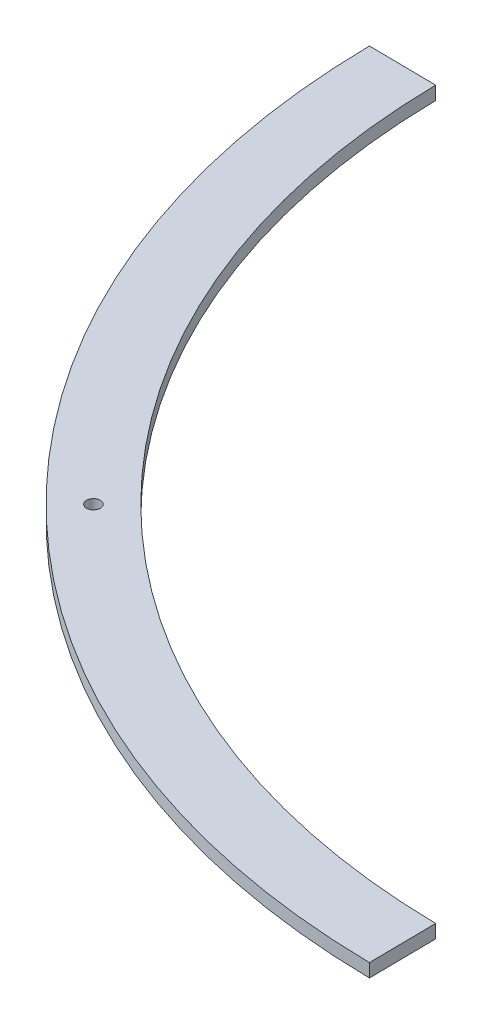
from build123d import *

# Parameters (mm, degrees)
SKETCH1_R           = 1.55
BOSS_EXTRUDE1_DEPTH = 3


with BuildPart() as part:
    # Sketch1 → Boss-Extrude1 (new body)
    with BuildSketch(Plane(origin=(0, 0, 0), x_dir=(1, 0, 0), z_dir=(0, 1, 0))):
        with BuildLine():
            Line((-90, 87.922824157), (-74.984658378, 87.75))
            ThreePointArc((-74.984658378, 87.75), (-26.673210325, -26.672027463), (87.748327336, -74.984635558))
            Line((87.748327336, -74.984635558), (87.922824157, -90))
            ThreePointArc((87.922824157, -90), (-37.287695123, -37.287695123), (-90, 87.922824157))
        make_face()
        with Locations(Location((-31.975919755, -31.975919755, 0), (0, 0, 270))):
            Circle(SKETCH1_R, mode=Mode.SUBTRACT)
    extrude(amount=BOSS_EXTRUDE1_DEPTH)


solid = part.part
